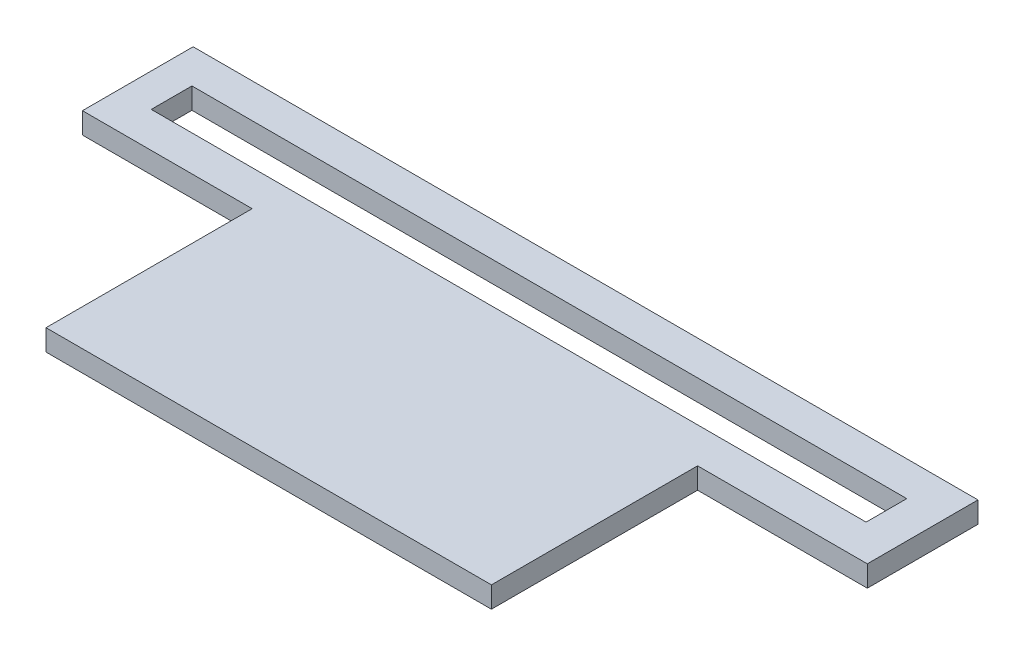
from build123d import *

# Parameters (mm, degrees)
ESQUISSE1_W        = 63.28
ESQUISSE1_H        = 3.6
BOSS_EXTRU_3_DEPTH = 1.87


with BuildPart() as part:
    # Esquisse1 → Boss.-Extru.3 (new body)
    with BuildSketch(Plane(origin=(0, 0, 0), x_dir=(1, 0, 0), z_dir=(0, 1, 0))):
        Polygon((-34.589747859, 18.205974345), (-34.589747859, 28.005974345), (34.890252141, 28.005974345), (34.890252141, 18.205974345), (19.865252141, 18.205974345), (19.865252141, -0.044025655), (-19.564747859, -0.044025655), (-19.564747859, 18.205974345), align=None)
        with Locations((0, 23.15)):
            Rectangle(ESQUISSE1_W, ESQUISSE1_H, mode=Mode.SUBTRACT)
    extrude(amount=BOSS_EXTRU_3_DEPTH)


solid = part.part
